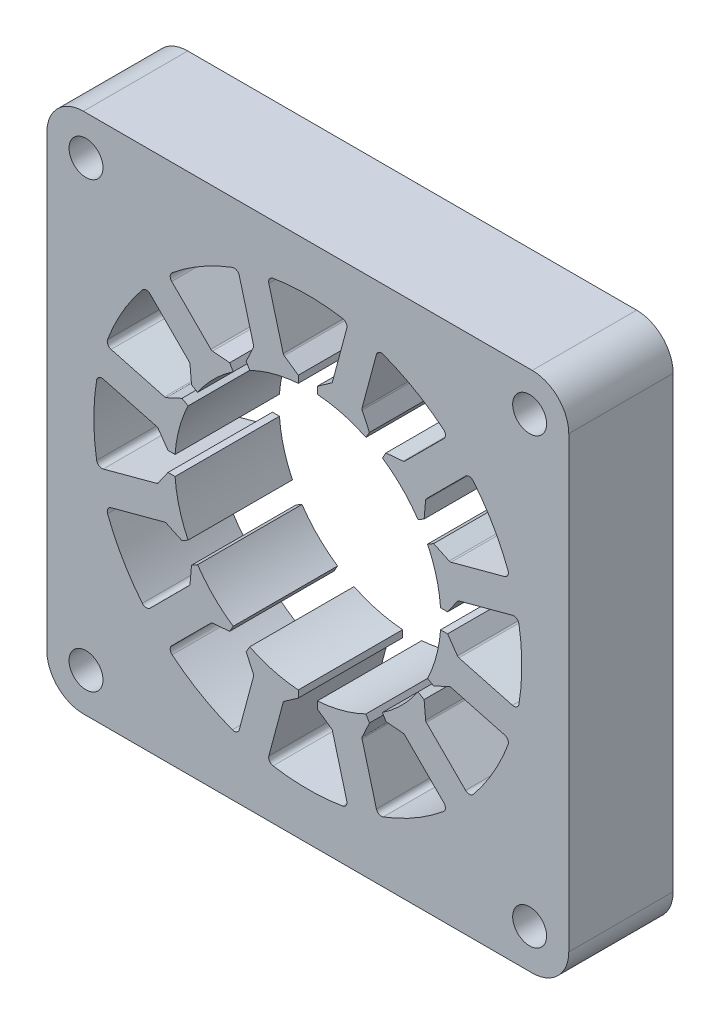
from build123d import *

# Parameters (mm, degrees)
SKETCH1_W                              = 100
SKETCH1_H                              = 100
SKETCH1_R                              = 25.5
LAMINATION_EXTRUCTION_DEPTH            = 20
SLOT_CUT_DEPTH                         = 74.484692283
SLOT_FILLET_TOP_R                      = 1
SLOT_FILLET_BOTTOM_R                   = 0.5
SLOT_DUPLICATE_COUNT                   = 12
SLOT_FILLET_TOP_OF_SLOT_DUPLICATE_R    = 1
SLOT_FILLET_BOTTOM_OF_SLOT_DUPLICATE_R = 0.5
SKETCH3_R                              = 3.25
BOLT_HOLE_CUT_DEPTH                    = 74.484692283
CORNER_FILLET_R                        = 7


with BuildPart() as part:
    # Sketch1 → Lamination Extruction (new body)
    with BuildSketch(Plane.XY):
        Rectangle(SKETCH1_W, SKETCH1_H)
        Circle(SKETCH1_R, mode=Mode.SUBTRACT)
    extrude(amount=LAMINATION_EXTRUCTION_DEPTH)

    # Sketch2 → Slot Cut (cut, through all)
    with BuildSketch(Plane.XY.offset(20)):
        with BuildLine():
            Line((4.673479277, 28.779136449), (7.75, 40.260868098))
            ThreePointArc((7.75, 40.260868098), (0, 41), (-7.75, 40.260868098))
            Line((-7.75, 40.260868098), (-4.673479277, 28.779136449))
            Line((-4.673479277, 28.779136449), (-1.825, 26.784609787))
            Line((-1.825, 26.784609787), (-1.825, 25.434609787))
            ThreePointArc((-1.825, 25.434609787), (0, 25.5), (1.825, 25.434609787))
            Line((1.825, 25.434609787), (1.825, 26.784609787))
            Line((1.825, 26.784609787), (4.673479277, 28.779136449))
        make_face()
    slot_cut = extrude(amount=-SLOT_CUT_DEPTH, mode=Mode.SUBTRACT)

    # Slot Fillet Top
    slot_fillet_top_edges = [part.edges().sort_by_distance(p)[0] for p in [
        (7.75, 40.260868098, 10),
        (-7.75, 40.260868098, 10),
    ]]
    fillet(slot_fillet_top_edges, radius=SLOT_FILLET_TOP_R)

    # Slot Fillet Bottom
    slot_fillet_bottom_edges = [part.edges().sort_by_distance(p)[0] for p in [
        (4.673479277, 28.779136449, 10),
        (-4.673479277, 28.779136449, 10),
    ]]
    fillet(slot_fillet_bottom_edges, radius=SLOT_FILLET_BOTTOM_R)

    # Slot Duplicate: Slot Cut ×12 about axis
    slot_duplicate_axis = Axis((0, 0, 20), (0, 0, -1))
    for i in range(1, SLOT_DUPLICATE_COUNT):
        add(slot_cut.rotate(slot_duplicate_axis, i * 360 / SLOT_DUPLICATE_COUNT), mode=Mode.SUBTRACT)

    # Slot Fillet Top of Slot Duplicate
    slot_fillet_top_of_slot_duplicate_edges = [part.edges().sort_by_distance(p)[0] for p in [
        (26.842130928, 30.991934551, 10),
        (13.41873717, 38.741934551, 10),
        (38.741934551, 13.41873717, 10),
        (30.991934551, 26.842130928, 10),
        (40.260868098, -7.75, 10),
        (40.260868098, 7.75, 10),
        (30.991934551, -26.842130928, 10),
        (38.741934551, -13.41873717, 10),
        (13.41873717, -38.741934551, 10),
        (26.842130928, -30.991934551, 10),
        (-7.75, -40.260868098, 10),
        (7.75, -40.260868098, 10),
        (-26.842130928, -30.991934551, 10),
        (-13.41873717, -38.741934551, 10),
        (-38.741934551, -13.41873717, 10),
        (-30.991934551, -26.842130928, 10),
        (-40.260868098, 7.75, 10),
        (-40.260868098, -7.75, 10),
        (-30.991934551, 26.842130928, 10),
        (-38.741934551, 13.41873717, 10),
        (-13.41873717, 38.741934551, 10),
        (-26.842130928, 30.991934551, 10),
    ]]
    fillet(slot_fillet_top_of_slot_duplicate_edges, radius=SLOT_FILLET_TOP_OF_SLOT_DUPLICATE_R)

    # Slot Fillet Bottom of Slot Duplicate
    slot_fillet_bottom_of_slot_duplicate_edges = [part.edges().sort_by_distance(p)[0] for p in [
        (18.436920002, 22.586723625, 10),
        (10.342216447, 27.260202902, 10),
        (27.260202902, 10.342216447, 10),
        (22.586723625, 18.436920002, 10),
        (28.779136449, -4.673479277, 10),
        (28.779136449, 4.673479277, 10),
        (22.586723625, -18.436920002, 10),
        (27.260202902, -10.342216447, 10),
        (10.342216447, -27.260202902, 10),
        (18.436920002, -22.586723625, 10),
        (-4.673479277, -28.779136449, 10),
        (4.673479277, -28.779136449, 10),
        (-18.436920002, -22.586723625, 10),
        (-10.342216447, -27.260202902, 10),
        (-27.260202902, -10.342216447, 10),
        (-22.586723625, -18.436920002, 10),
        (-28.779136449, 4.673479277, 10),
        (-28.779136449, -4.673479277, 10),
        (-22.586723625, 18.436920002, 10),
        (-27.260202902, 10.342216447, 10),
        (-10.342216447, 27.260202902, 10),
        (-18.436920002, 22.586723625, 10),
    ]]
    fillet(slot_fillet_bottom_of_slot_duplicate_edges, radius=SLOT_FILLET_BOTTOM_OF_SLOT_DUPLICATE_R)

    # Sketch3 → Bolt Hole Cut (cut, through all)
    with BuildSketch(Plane.XY.offset(20)):
        with Locations((-42.5, 42.5)):
            Circle(SKETCH3_R)
        with Locations((42.5, 42.5)):
            Circle(SKETCH3_R)
        with Locations((42.5, -42.5)):
            Circle(SKETCH3_R)
        with Locations((-42.5, -42.5)):
            Circle(SKETCH3_R)
    extrude(amount=-BOLT_HOLE_CUT_DEPTH, mode=Mode.SUBTRACT)

    # Corner Fillet
    corner_fillet_edges = [part.edges().sort_by_distance(p)[0] for p in [
        (-50, 50, 10),
        (-50, -50, 10),
        (50, -50, 10),
        (50, 50, 10),
    ]]
    fillet(corner_fillet_edges, radius=CORNER_FILLET_R)


solid = part.part
